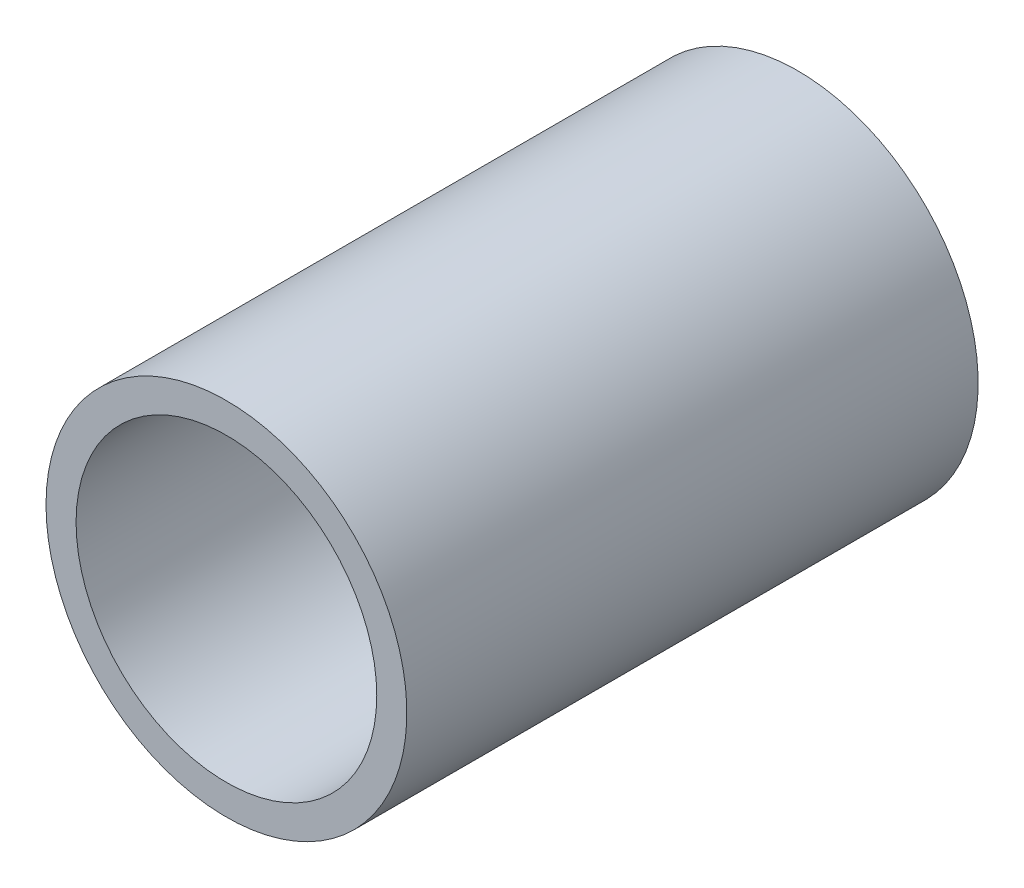
from build123d import *

# Parameters (mm, degrees)
SKETCH1_R           = 9.525
SKETCH1_R_2         = 7.9375
BOSS_EXTRUDE1_DEPTH = 30.1625


with BuildPart() as part:
    # Sketch1 → Boss-Extrude1 (new body)
    with BuildSketch(Plane.XY):
        with Locations(Location((0, 0, 0), (0, 0, 180))):
            Circle(SKETCH1_R)
        with Locations(Location((0, 0, 0), (0, 0, 180))):
            Circle(SKETCH1_R_2, mode=Mode.SUBTRACT)
    extrude(amount=BOSS_EXTRUDE1_DEPTH)


solid = part.part
